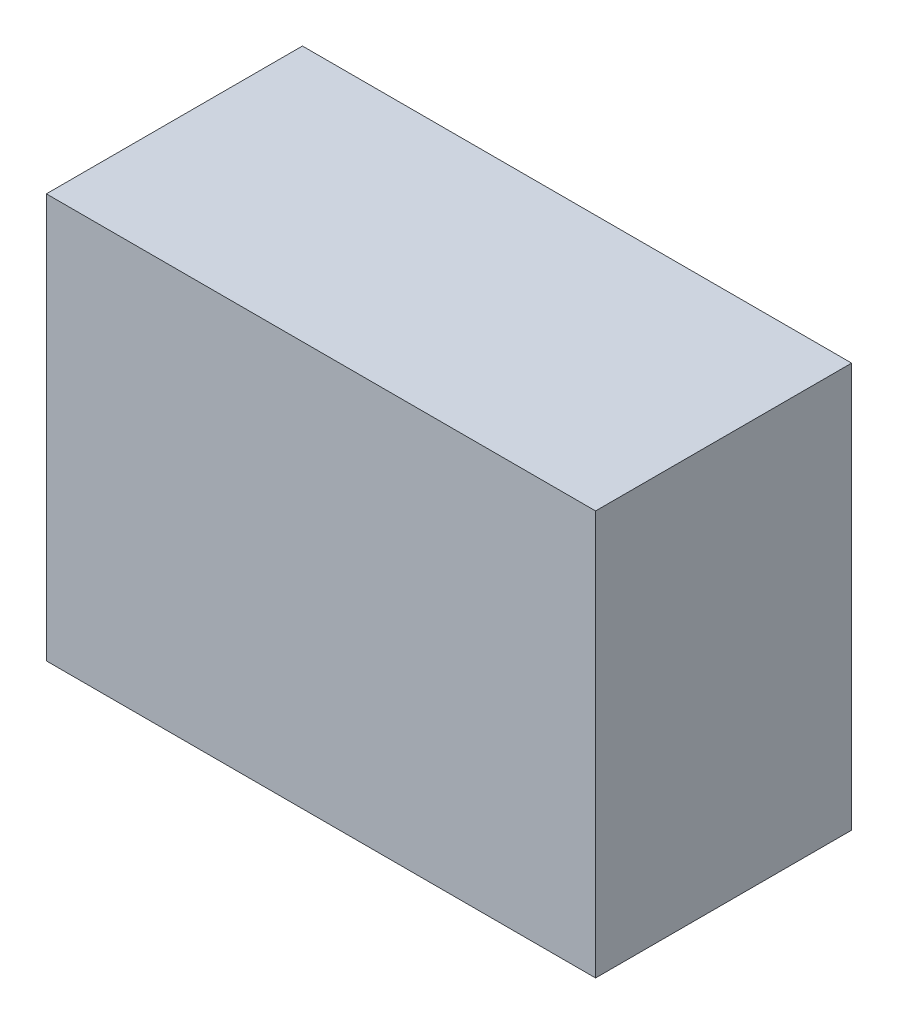
from build123d import *

# Parameters (mm, degrees)
SKETCH1_W           = 14.8
SKETCH1_H           = 6.9
BOSS_EXTRUDE1_DEPTH = 10.9


with BuildPart() as part:
    # Sketch1 → Boss-Extrude1 (new body)
    with BuildSketch(Plane(origin=(0, 0, 0), x_dir=(1, 0, 0), z_dir=(0, 1, 0))):
        with Locations((7.4, 3.45)):
            Rectangle(SKETCH1_W, SKETCH1_H)
    extrude(amount=BOSS_EXTRUDE1_DEPTH)


solid = part.part
